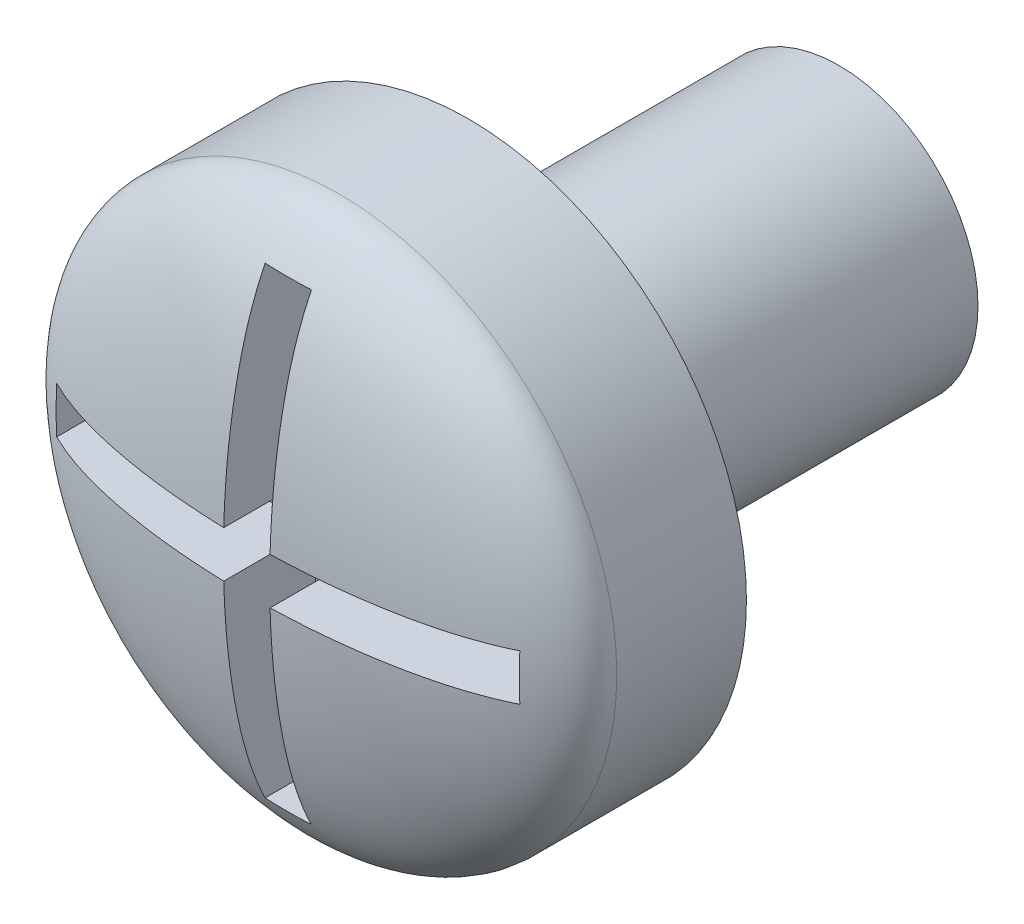
from build123d import *

# Parameters (mm, degrees)
BOSS_EXTRUDE3_START = -1
SKETCH1_R           = 3
BOSS_EXTRUDE3_DEPTH = 1.4
DOME1_FACE_RADIUS   = 3
DOME1_HEIGHT        = 1
SKETCH4_R           = 1.5
BOSS_EXTRUDE4_DEPTH = 4
CUT_EXTRUDE1_DEPTH  = 1


with BuildPart() as part:
    # Sketch1 → Boss-Extrude3 (new body)
    with BuildSketch(Plane.XY.offset(BOSS_EXTRUDE3_START)):
        Circle(SKETCH1_R)
    extrude(amount=-BOSS_EXTRUDE3_DEPTH)

    # Dome1: an elliptical dome of height H over a round flat face of radius A is half a spheroid: the quarter ellipse of half axes A and H revolved about the face's axis
    with BuildSketch(Plane((0, 0, -1), x_dir=(0, 1, 0), z_dir=(1, 0, 0)), mode=Mode.PRIVATE) as dome1_quarter:
        Ellipse(DOME1_FACE_RADIUS, DOME1_HEIGHT)
        Rectangle(DOME1_FACE_RADIUS, DOME1_HEIGHT, align=(Align.MIN, Align.MIN), mode=Mode.INTERSECT)
    revolve(dome1_quarter.sketch, axis=Axis((0, 0, -1), (0, 0, 1)))

    # Sketch4 → Boss-Extrude4 (add)
    with BuildSketch(Plane(origin=(0, 0, -2.4), x_dir=(-1, 0, 0), z_dir=(0, 0, -1))):
        Circle(SKETCH4_R)
    extrude(amount=BOSS_EXTRUDE4_DEPTH)

    # Sketch5 → Cut-Extrude1 (cut)
    with BuildSketch(Plane.XY):
        Polygon((0.25, 2.5), (-0.25, 2.5), (-0.25, 0.25), (-2.5, 0.25), (-2.5, -0.25), (-0.25, -0.25), (-0.25, -2.5), (0.25, -2.5), (0.25, -0.25), (2.5, -0.25), (2.5, 0.25), (0.25, 0.25), align=None)
    extrude(amount=-CUT_EXTRUDE1_DEPTH, mode=Mode.SUBTRACT)


solid = part.part
